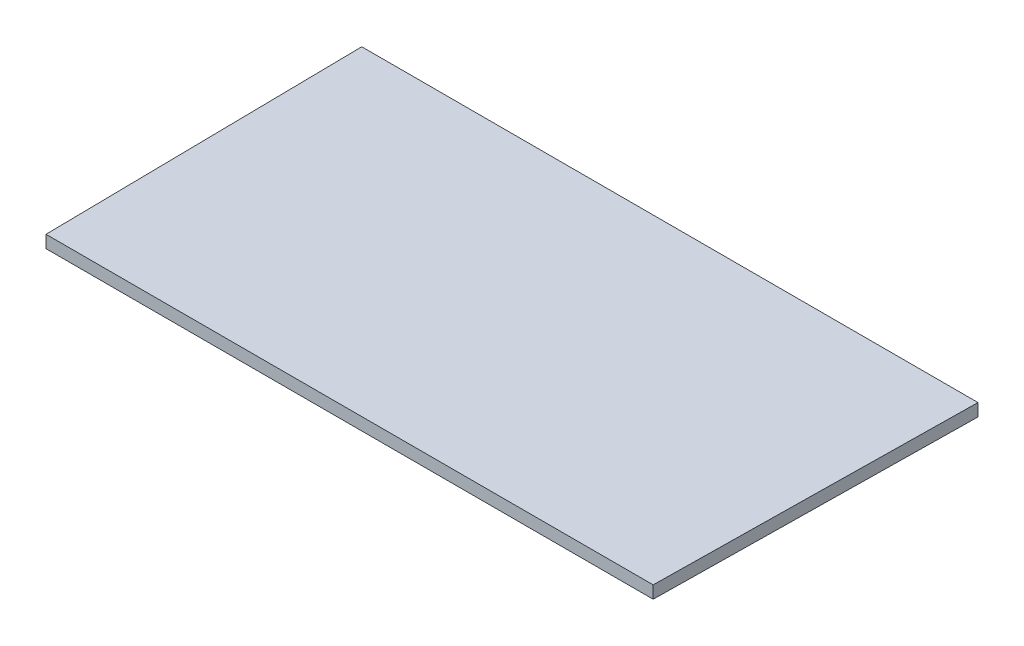
from build123d import *

# Parameters (mm, degrees)
BOSS_EXTRUDE1_DEPTH = 3


with BuildPart() as part:
    # Sketch1 → Boss-Extrude1 (new body)
    with BuildSketch(Plane(origin=(0, 0, 0), x_dir=(1, 0, 0), z_dir=(0, 1, 0))):
        Polygon((-72.98636562, 0), (72.98636562, 0), (74.075, 77), (-74.075, 77), align=None)
    extrude(amount=BOSS_EXTRUDE1_DEPTH)


solid = part.part
